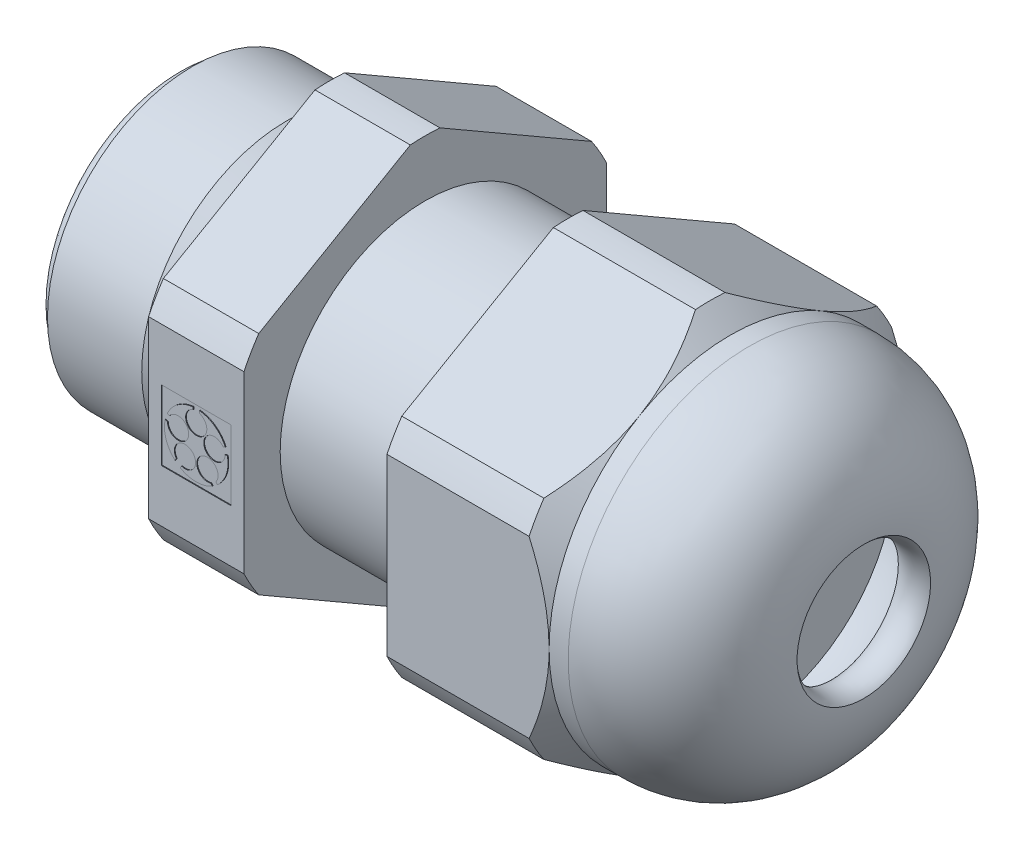
from build123d import *

# Parameters (mm, degrees)
ESQUISSE2_W             = 38
ESQUISSE2_H             = 38
ENL_V_MAT_EXTRU_1_DEPTH = 36
ESQUISSE3_W             = 3.666666666
ESQUISSE3_H             = 3.666666666
ENL_V_MAT_EXTRU_2_DEPTH = 0.038


with BuildPart() as part:
    # Esquisse1 → Révolution1 (revolve)
    with BuildSketch(Plane.XY, mode=Mode.PRIVATE) as r_volution1_sk:
        with BuildLine():
            Line((0.585, 1.75), (30, 1.75))
            Line((30, 1.75), (30, 7.6))
            ThreePointArc((30, 7.6), (32.507864279, 6.743550024), (33.967991826, 4.532008174))
            ThreePointArc((33.967991826, 4.532008174), (34.610930007, 3.281443073), (36, 3.5))
            ThreePointArc((36, 3.5), (34.242640687, 7.742640687), (30, 9.5))
            Line((30, 9.5), (29, 9.5))
            Line((29, 9.5), (25.833333333, 12.666666667))
            Line((25.833333333, 12.666666667), (20.5, 12.666666667))
            Line((20.5, 12.666666667), (20.5, 7.6))
            Line((20.5, 7.6), (13, 7.6))
            Line((13, 7.6), (13, 12.666666667))
            Line((13, 12.666666667), (8, 12.666666667))
            Line((8, 12.666666667), (8, 7.22))
            Line((8, 7.22), (6.4, 7.22))
            Line((6.4, 7.22), (5.741820693, 7.6))
            Line((5.741820693, 7.6), (0.8, 7.6))
            Line((0.8, 7.6), (0.8, 7.22))
            Line((0.8, 7.22), (0.585, 7.22))
            ThreePointArc((0.585, 7.22), (0.171342533, 7.048657467), (0, 6.635))
            Line((0, 6.635), (0, 2.335))
            ThreePointArc((0, 2.335), (0.171342533, 1.921342533), (0.585, 1.75))
        make_face()
    revolve(r_volution1_sk.sketch.rotate(Axis((36, 0, 0), (-1, 0, 0)), 90), axis=Axis((36, 0, 0), (-1, 0, 0)))

    # Esquisse2 → Enlèv. mat.-Extru.1 (cut)
    with BuildSketch(Plane(origin=(8, 0, 0), x_dir=(0, 0, -1), z_dir=(1, 0, 0))):
        Rectangle(ESQUISSE2_W, ESQUISSE2_H)
        with BuildLine():
            Line((-9.5, 4.588300339), (-9.5, -4.588300339))
            ThreePointArc((-9.5, -4.588300339), (-9.13656801, -5.275), (-8.723584654, -5.933091166))
            Line((-8.723584654, -5.933091166), (-0.776415346, -10.521391505))
            ThreePointArc((-0.776415346, -10.521391505), (0, -10.55), (0.776415346, -10.521391505))
            Line((0.776415346, -10.521391505), (8.723584654, -5.933091166))
            ThreePointArc((8.723584654, -5.933091166), (9.13656801, -5.275), (9.5, -4.588300339))
            Line((9.5, -4.588300339), (9.5, 4.588300339))
            ThreePointArc((9.5, 4.588300339), (9.13656801, 5.275), (8.723584654, 5.933091166))
            Line((8.723584654, 5.933091166), (0.776415346, 10.521391505))
            ThreePointArc((0.776415346, 10.521391505), (0, 10.55), (-0.776415346, 10.521391505))
            Line((-0.776415346, 10.521391505), (-8.723584654, 5.933091166))
            ThreePointArc((-8.723584654, 5.933091166), (-9.13656801, 5.275), (-9.5, 4.588300339))
        make_face(mode=Mode.SUBTRACT)
    extrude(amount=ENL_V_MAT_EXTRU_1_DEPTH, mode=Mode.SUBTRACT)

    # Esquisse3 → Enlèv. mat.-Extru.2 (cut)
    with BuildSketch(Plane.XY.offset(9.5)):
        with Locations((10.5, 0)):
            Rectangle(ESQUISSE3_W, ESQUISSE3_H)
        with BuildLine():
            Line((9.390432265, -1.243638701), (9.465872252, -1.139804467))
            ThreePointArc((9.465872252, -1.139804467), (10.23876211, -0.359563109), (9.735544583, -1.335732884))
            Line((9.735544583, -1.335732884), (9.660104596, -1.439567118))
            ThreePointArc((9.660104596, -1.439567118), (10.5, -1.666666667), (11.339895404, -1.439567118))
            Line((11.339895404, -1.439567118), (11.264455417, -1.335732884))
            ThreePointArc((11.264455417, -1.335732884), (10.76123789, -0.359563109), (11.534127748, -1.139804467))
            Line((11.534127748, -1.139804467), (11.609567735, -1.243638701))
            ThreePointArc((11.609567735, -1.243638701), (12.085094194, -0.515028324), (12.128651642, 0.353937293))
            Line((12.128651642, 0.353937293), (12.006587179, 0.314276144))
            ThreePointArc((12.006587179, 0.314276144), (10.922691785, 0.137340886), (11.903581514, 0.631294983))
            Line((11.903581514, 0.631294983), (12.025645977, 0.670956131))
            ThreePointArc((12.025645977, 0.670956131), (11.479642087, 1.348361657), (10.666666667, 1.658312395))
            Line((10.666666667, 1.658312395), (10.666666667, 1.529966223))
            ThreePointArc((10.666666667, 1.529966223), (10.5, 0.444444444), (10.333333333, 1.529966223))
            Line((10.333333333, 1.529966223), (10.333333333, 1.658312395))
            ThreePointArc((10.333333333, 1.658312395), (9.520357913, 1.348361657), (8.974354023, 0.670956131))
            Line((8.974354023, 0.670956131), (9.096418486, 0.631294983))
            ThreePointArc((9.096418486, 0.631294983), (10.077308215, 0.137340886), (8.993412821, 0.314276144))
            Line((8.993412821, 0.314276144), (8.871348358, 0.353937293))
            ThreePointArc((8.871348358, 0.353937293), (8.914905806, -0.515028324), (9.390432265, -1.243638701))
        make_face(mode=Mode.SUBTRACT)
    extrude(amount=-ENL_V_MAT_EXTRU_2_DEPTH, mode=Mode.SUBTRACT)


solid = part.part
